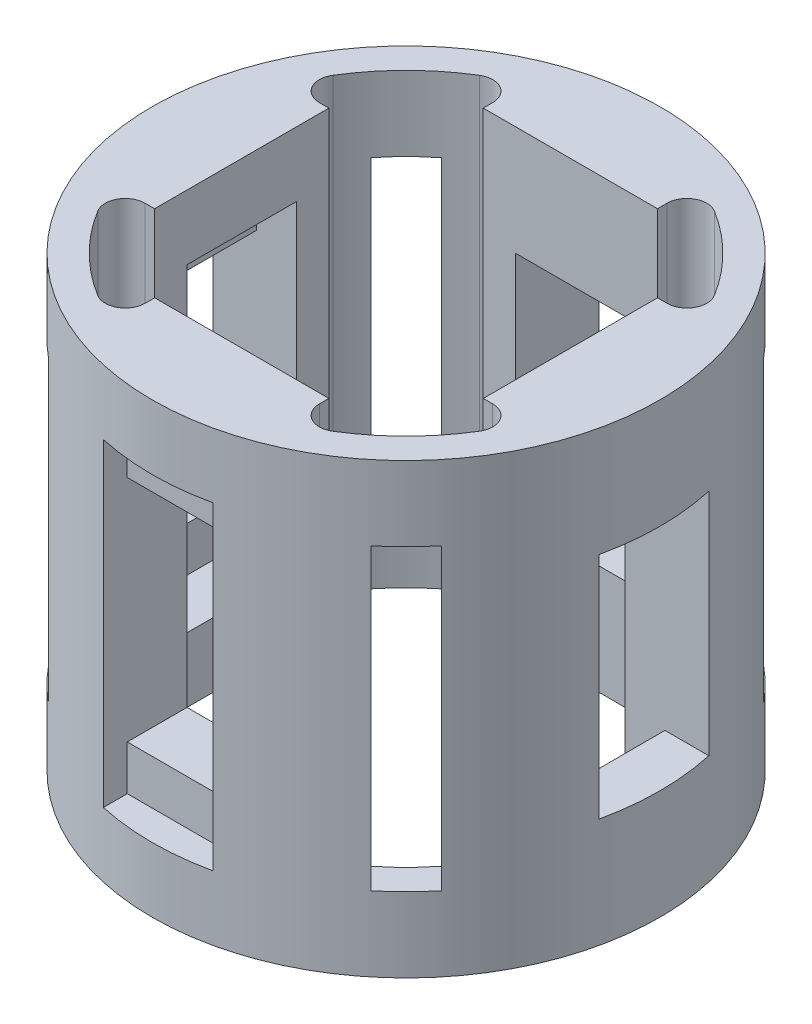
from build123d import *

# Parameters (mm, degrees)
SKETCH1_R                = 25.5
BOSS_EXTRUDE1_DEPTH      = 45
FILLET1_R                = 2
CUT_EXTRUDE1_DEPTH       = 58.66714836
CUT_EXTRUDE1_DEPTH_BACK  = 58.66714836
CUT_EXTRUDE2_DEPTH       = 58.66714836
CUT_EXTRUDE2_DEPTH_BACK  = 58.66714836
CUT_EXTRUDE3_DEPTH       = 58.66714836
CUT_EXTRUDE3_DEPTH_BACK  = 58.66714836
CUT_EXTRUDE4_DEPTH       = 58.66714836
CUT_EXTRUDE4_DEPTH_BACK  = 58.66714836
SKETCH10_W               = 11
SKETCH10_H               = 4.5
CUT_EXTRUDE11_DEPTH      = 5
SKETCH6_W                = 11
SKETCH6_H                = 4.5
CUT_EXTRUDE12_DEPTH      = 4
SKETCH7_W                = 11
SKETCH7_H                = 4.5
CUT_EXTRUDE13_DEPTH      = 4
SKETCH11_W               = 11
SKETCH11_H               = 4.5
CUT_EXTRUDE14_DEPTH      = 3
CUT_EXTRUDE17_DEPTH      = 3
CUT_EXTRUDE17_DEPTH_BACK = 3
SKETCH13_W               = 11
SKETCH13_H               = 4.5


with BuildPart() as part:
    # Sketch1 → Boss-Extrude1 (new body)
    with BuildSketch(Plane(origin=(0, 0, 0), x_dir=(1, 0, 0), z_dir=(0, 1, 0))):
        Circle(SKETCH1_R)
        with BuildLine():
            Line((-8.75, -16.500006), (-8.75, -20.72890494))
            ThreePointArc((-8.75, -20.72890494), (-15.909902577, -15.909902577), (-20.72890494, -8.75))
            Line((-20.72890494, -8.75), (-16.5, -8.75))
            Line((-16.5, -8.75), (-16.5, 8.75))
            Line((-16.5, 8.75), (-20.72890494, 8.75))
            ThreePointArc((-20.72890494, 8.75), (-15.909902577, 15.909902577), (-8.75, 20.72890494))
            Line((-8.75, 20.72890494), (-8.75, 16.5))
            Line((-8.75, 16.5), (8.75, 16.5))
            Line((8.75, 16.5), (8.75, 20.72890494))
            ThreePointArc((8.75, 20.72890494), (15.909902577, 15.909902577), (20.72890494, 8.75))
            Line((20.72890494, 8.75), (16.5, 8.75))
            Line((16.5, 8.75), (16.5, -8.75))
            Line((16.5, -8.75), (20.72890494, -8.75))
            ThreePointArc((20.72890494, -8.75), (15.909902577, -15.909902577), (8.75, -20.72890494))
            Line((8.75, -20.72890494), (8.75, -16.500006))
            Line((8.75, -16.500006), (-8.75, -16.500006))
        make_face(mode=Mode.SUBTRACT)
    extrude(amount=BOSS_EXTRUDE1_DEPTH)

    # Fillet1
    fillet1_edges = [part.edges().sort_by_distance(p)[0] for p in [
        (20.72890494, 22.5, -8.75),
        (20.72890494, 22.5, 8.75),
        (8.75, 22.5, 20.72890494),
        (-8.75, 22.5, -20.72890494),
        (8.75, 22.5, -20.72890494),
        (-8.75, 22.5, 20.72890494),
        (-20.72890494, 22.5, 8.75),
        (-20.72890494, 22.5, -8.75),
    ]]
    fillet(fillet1_edges, radius=FILLET1_R)

    # Sketch2 → Cut-Extrude1 (cut, two sides: drawn at the far end of the back side and taken through both)
    with BuildSketch(Plane(origin=(0, 0, 0), x_dir=(-0.7071067811865477, 0, -0.7071067811865475), z_dir=(0.7071067811865475, 0, -0.7071067811865477)).offset(-CUT_EXTRUDE1_DEPTH_BACK)):
        Polygon((0, 7.5), (2.5, 7.5), (2.5, 37.5), (-2.5, 37.5), (-2.5, 7.5), align=None)
    extrude(amount=CUT_EXTRUDE1_DEPTH + CUT_EXTRUDE1_DEPTH_BACK, mode=Mode.SUBTRACT)

    # Sketch3 → Cut-Extrude2 (cut, two sides: drawn at the far end of the back side and taken through both)
    with BuildSketch(Plane(origin=(0, 0, 0), x_dir=(0.7071067811865476, 0, -0.7071067811865476), z_dir=(0.7071067811865476, 0, 0.7071067811865476)).offset(-CUT_EXTRUDE2_DEPTH_BACK)):
        Polygon((2.5, 7.5), (2.5, 37.5), (-2.5, 37.5), (-2.5, 7.5), (0, 7.5), align=None)
    extrude(amount=CUT_EXTRUDE2_DEPTH + CUT_EXTRUDE2_DEPTH_BACK, mode=Mode.SUBTRACT)

    # Sketch4 → Cut-Extrude3 (cut, two sides: drawn at the far end of the back side and taken through both)
    with BuildSketch(Plane.XY.offset(-CUT_EXTRUDE3_DEPTH_BACK)):
        Polygon((5.5, 34), (-5.5, 34), (-5.5, 11), (0, 11), (5.5, 11), align=None)
    extrude(amount=CUT_EXTRUDE3_DEPTH + CUT_EXTRUDE3_DEPTH_BACK, mode=Mode.SUBTRACT)

    # Sketch5 → Cut-Extrude4 (cut, two sides: drawn at the far end of the back side and taken through both)
    with BuildSketch(Plane(origin=(0, 0, 0), x_dir=(0, 0, -1), z_dir=(1, 0, 0)).offset(-CUT_EXTRUDE4_DEPTH_BACK)):
        Polygon((0, 11), (5.5, 11), (5.5, 34), (-5.5, 34), (-5.5, 11), align=None)
    extrude(amount=CUT_EXTRUDE4_DEPTH + CUT_EXTRUDE4_DEPTH_BACK, mode=Mode.SUBTRACT)

    # Sketch10 → Cut-Extrude11 (cut)
    with BuildSketch(Plane(origin=(-16.5, 0, 0), x_dir=(0, 0, -1), z_dir=(1, 0, 0))):
        with Locations((0, 8.75)):
            Rectangle(SKETCH10_W, SKETCH10_H)
    extrude(amount=-CUT_EXTRUDE11_DEPTH, mode=Mode.SUBTRACT)

    # Sketch6 → Cut-Extrude12 (cut)
    with BuildSketch(Plane.ZY.offset(-16.5)):
        with Locations((0, 36.25)):
            Rectangle(SKETCH6_W, SKETCH6_H)
        with Locations((0, 8.75)):
            Rectangle(SKETCH6_W, SKETCH6_H)
    extrude(amount=-CUT_EXTRUDE12_DEPTH, mode=Mode.SUBTRACT)

    # Sketch7 → Cut-Extrude13 (cut)
    with BuildSketch(Plane(origin=(-16.5, 0, 0), x_dir=(0, 0, -1), z_dir=(1, 0, 0))):
        with Locations((0, 36.25)):
            Rectangle(SKETCH7_W, SKETCH7_H)
        with Locations((0, 8.75)):
            Rectangle(SKETCH7_W, SKETCH7_H)
    extrude(amount=-CUT_EXTRUDE13_DEPTH, mode=Mode.SUBTRACT)

    # Sketch11 → Cut-Extrude14 (cut)
    with BuildSketch(Plane.XY.offset(25.500000054)):
        with Locations((0, 8.75)):
            Rectangle(SKETCH11_W, SKETCH11_H)
        with Locations((0, 36.25)):
            Rectangle(SKETCH11_W, SKETCH11_H)
    extrude(amount=-CUT_EXTRUDE14_DEPTH, mode=Mode.SUBTRACT)

    # Sketch13 → Cut-Extrude17 (cut, two sides: drawn at the far end of the back side and taken through both)
    with BuildSketch(Plane.XY.offset(-25.500000054).offset(-CUT_EXTRUDE17_DEPTH_BACK)):
        with Locations((0, 36.25)):
            Rectangle(SKETCH13_W, SKETCH13_H)
        with Locations((0, 8.75)):
            Rectangle(SKETCH13_W, SKETCH13_H)
    extrude(amount=CUT_EXTRUDE17_DEPTH + CUT_EXTRUDE17_DEPTH_BACK, mode=Mode.SUBTRACT)


solid = part.part
